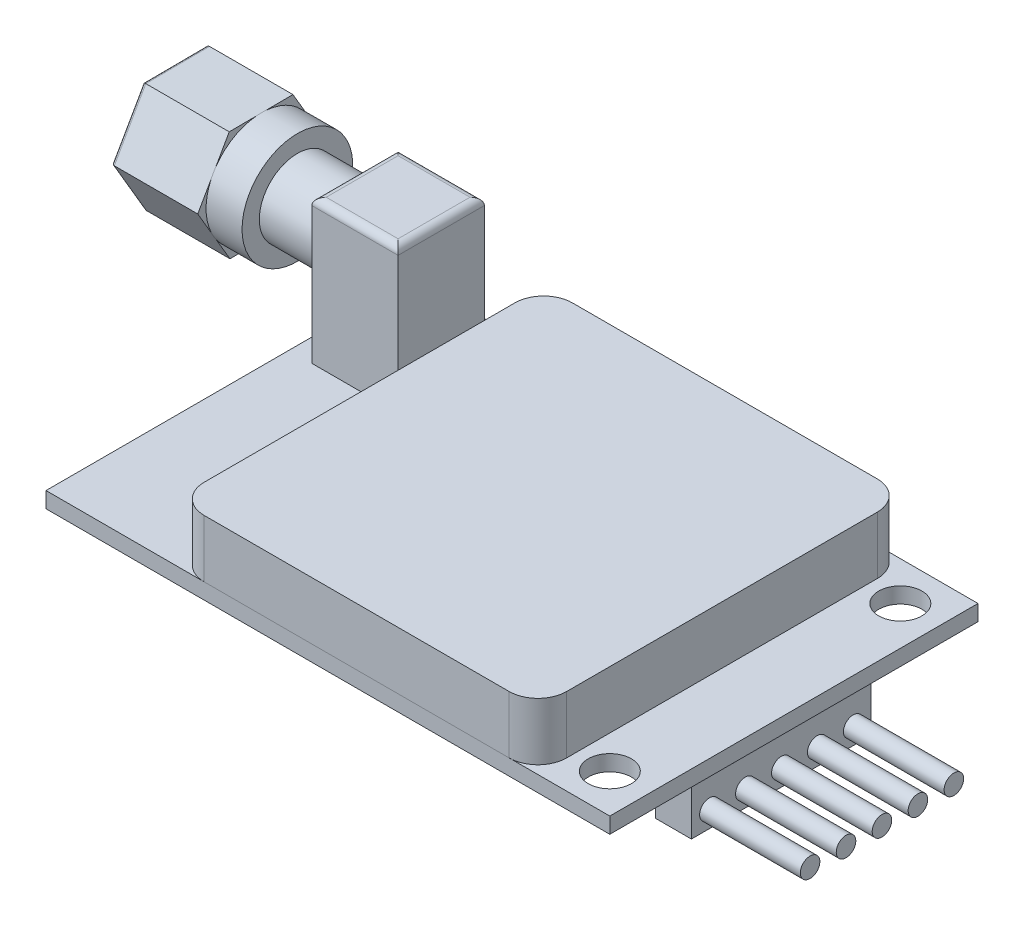
from build123d import *

# Parameters (mm, degrees)
SKETCH_1_W          = 39.2
SKETCH_1_H          = 25.6
SKETCH_1_R          = 1.5
EXTRUDE_1_DEPTH     = 1.1
SKETCH_1_4_W        = 25.2
SKETCH_1_4_H        = 25.6
EXTRUDE_3_DEPTH     = 4
FILLET_1_R          = 2
SKETCH_2_W          = 6
SKETCH_2_H          = 6
EXTRUDE_4_DEPTH     = 10
FILLET_2_R          = 0.5
SKETCH_3_R          = 2.65
EXTRUDE_5_DEPTH     = 4
SKETCH_4_R          = 3.85
EXTRUDE_6_DEPTH     = 2.5
EXTRUDE_7_DEPTH     = 6
SKETCH_6_R          = 3.15
CUT_EXTRUDE_1_DEPTH = 5
FILLET_3_R          = 0.2
SKETCH_7_W          = 2.5
SKETCH_7_H          = 12.5
EXTRUDE_8_DEPTH     = 4
SKETCH_8_R          = 0.68
EXTRUDE_9_DEPTH     = 7
SKETCH_9_W          = 9.763882412
SKETCH_9_H          = 13.621218674
EXTRUDE_10_DEPTH    = 2


with BuildPart() as part:
    # 草图1 → 凸台-拉伸1 (new body)
    with BuildSketch(Plane(origin=(0, 0, 0), x_dir=(1, 0, 0), z_dir=(0, 1, 0))):
        Rectangle(SKETCH_1_W, SKETCH_1_H)
        with Locations((16.9, 10.1)):
            Circle(SKETCH_1_R, mode=Mode.SUBTRACT)
        with Locations((16.9, -10.1)):
            Circle(SKETCH_1_R, mode=Mode.SUBTRACT)
    extrude(amount=-EXTRUDE_1_DEPTH)

    # 草图9 → 凸台-拉伸10 (add)
    with BuildSketch(Plane.XZ.offset(1.1)):
        with Locations((7.727328673, -0.934198626)):
            Rectangle(SKETCH_9_W, SKETCH_9_H)
    extrude(amount=EXTRUDE_10_DEPTH)


with BuildPart() as body_2:
    # 草图1<4> → 凸台-拉伸3 (new body)
    with BuildSketch(Plane(origin=(0, 0, 0), x_dir=(1, 0, 0), z_dir=(0, 1, 0))):
        with Locations((2, 0)):
            Rectangle(SKETCH_1_4_W, SKETCH_1_4_H)
    extrude(amount=EXTRUDE_3_DEPTH)

    # 圆角1
    fillet_1_edges = [body_2.edges().sort_by_distance(p)[0] for p in [
        (-10.6, 2, -12.8),
        (14.6, 2, -12.8),
        (14.6, 2, 12.8),
        (-10.6, 2, 12.8),
    ]]
    fillet(fillet_1_edges, radius=FILLET_1_R)


with BuildPart() as body_3:
    # 草图2 → 凸台-拉伸4 (new body)
    with BuildSketch(Plane(origin=(0, 0, 0), x_dir=(1, 0, 0), z_dir=(0, 1, 0))):
        with Locations((-15.02, 7.1)):
            Rectangle(SKETCH_2_W, SKETCH_2_H)
    extrude(amount=EXTRUDE_4_DEPTH)

    # 圆角2
    fillet_2_edges = [body_3.edges().sort_by_distance(p)[0] for p in [
        (-12.02, 10, -7.1),
        (-15.02, 10, -10.1),
        (-18.02, 10, -7.1),
        (-15.02, 10, -4.1),
    ]]
    fillet(fillet_2_edges, radius=FILLET_2_R)

    # 草图3 → 凸台-拉伸5 (add)
    with BuildSketch(Plane.ZY.offset(18.02)):
        with Locations((-7.1, 6.488063406)):
            Circle(SKETCH_3_R)
    extrude(amount=EXTRUDE_5_DEPTH)

    # 草图4 → 凸台-拉伸6 (add)
    with BuildSketch(Plane.ZY.offset(22.02)):
        with Locations((-7.1, 6.488063406)):
            Circle(SKETCH_4_R)
    extrude(amount=EXTRUDE_6_DEPTH)

    # 草图5 → 凸台-拉伸7 (add)
    with BuildSketch(Plane.ZY.offset(24.52)):
        Polygon((-4.910515511, 2.638063406), (-2.671059951, 6.459212594), (-4.86054444, 10.309212594), (-9.289484489, 10.338063406), (-11.528940049, 6.516914218), (-9.33945556, 2.666914218), align=None)
    extrude(amount=EXTRUDE_7_DEPTH)

    # 草图6 → 切除-拉伸1 (cut)
    with BuildSketch(Plane.ZY.offset(30.52)):
        with Locations((-7.075014464, 6.473420168)):
            Circle(SKETCH_6_R)
    extrude(amount=-CUT_EXTRUDE_1_DEPTH, mode=Mode.SUBTRACT)

    # 圆角3
    fillet_3_edges = [body_3.edges().sort_by_distance(p)[0] for p in [
        (-30.52, 8.384212594, -3.765802195),
        (-30.52, 4.548638, -3.790787731),
        (-30.52, 2.652488812, -7.124985536),
        (-30.52, 4.591914218, -10.434197805),
        (-30.52, 8.427488812, -10.409212269),
        (-30.52, 10.323638, -7.075014464),
    ]]
    fillet(fillet_3_edges, radius=FILLET_3_R)


with BuildPart() as body_4:
    # 草图7 → 凸台-拉伸8 (new body)
    with BuildSketch(Plane(origin=(0, -1.1, 0), x_dir=(-1, 0, 0), z_dir=(0, -1, 0))):
        with Locations((-17.473641974, 0)):
            Rectangle(SKETCH_7_W, SKETCH_7_H)
    extrude(amount=EXTRUDE_8_DEPTH)

    # 草图8 → 凸台-拉伸9 (add)
    with BuildSketch(Plane(origin=(18.723641974, 0, 0), x_dir=(0, 0, -1), z_dir=(1, 0, 0))):
        with Locations((-5, -3.923750137)):
            Circle(SKETCH_8_R)
        with Locations((-2.5, -3.923750137)):
            Circle(SKETCH_8_R)
        with Locations((0, -3.923750137)):
            Circle(SKETCH_8_R)
        with Locations((2.5, -3.923750137)):
            Circle(SKETCH_8_R)
        with Locations((5, -3.923750137)):
            Circle(SKETCH_8_R)
    extrude(amount=EXTRUDE_9_DEPTH)


solid = Compound([part.part, body_2.part, body_3.part, body_4.part])
